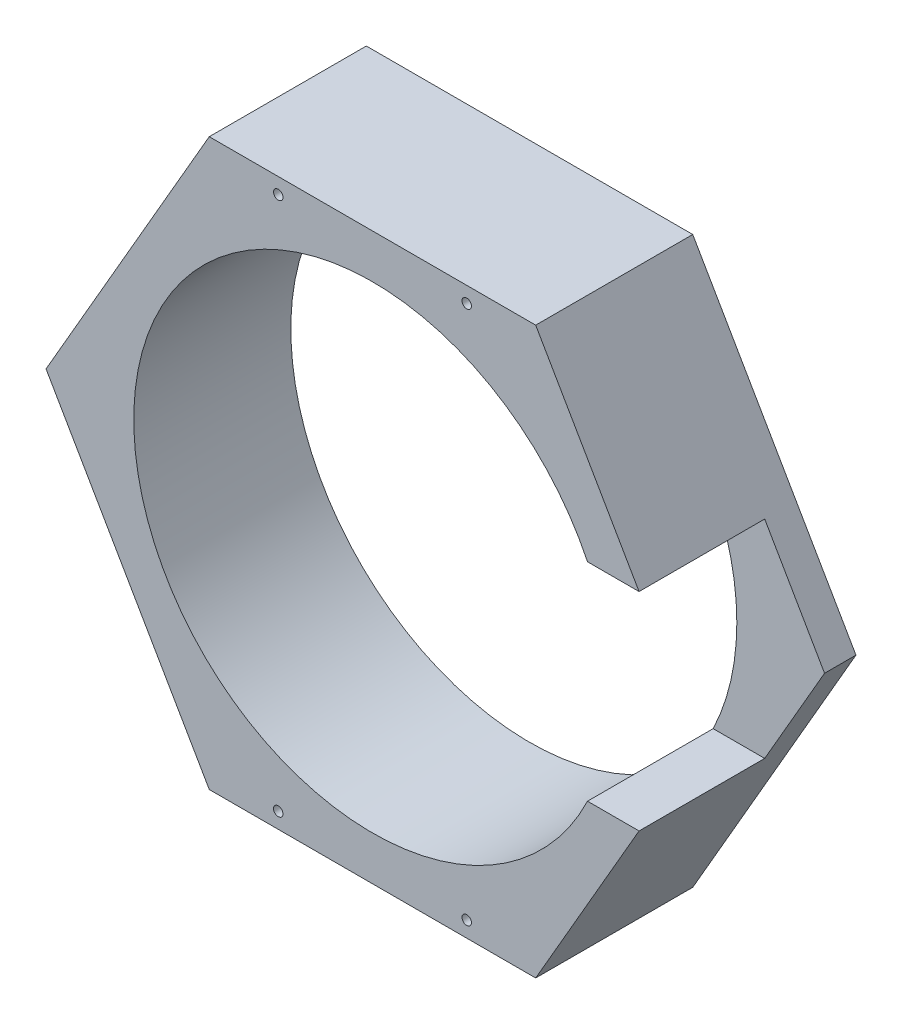
from build123d import *

# Parameters (mm, degrees)
SKETCH1_R           = 76
SKETCH1_R_2         = 1.5
BOSS_EXTRUDE1_DEPTH = 50
CUT_EXTRUDE1_START  = -40
CUT_EXTRUDE1_DEPTH  = 40


with BuildPart() as part:
    # Sketch1 → Boss-Extrude1 (new body)
    with BuildSketch(Plane.XY):
        Polygon((103.923048454, 0), (51.961524227, 90), (-51.961524227, 90), (-103.923048454, 0), (-51.961524227, -90), (51.961524227, -90), align=None)
        Circle(SKETCH1_R, mode=Mode.SUBTRACT)
        with Locations((30, -85)):
            Circle(SKETCH1_R_2, mode=Mode.SUBTRACT)
        with Locations((-30, -85)):
            Circle(SKETCH1_R_2, mode=Mode.SUBTRACT)
        with Locations((30, 85)):
            Circle(SKETCH1_R_2, mode=Mode.SUBTRACT)
        with Locations((-30, 85)):
            Circle(SKETCH1_R_2, mode=Mode.SUBTRACT)
    extrude(amount=BOSS_EXTRUDE1_DEPTH)

    # Sketch4 → Cut-Extrude1 (cut)
    with BuildSketch(Plane.XY.offset(50).offset(CUT_EXTRUDE1_START)):
        with BuildLine():
            ThreePointArc((68.461668107, 33), (74.091452868, 16.925029156), (76, 0))
            Line((76, 0), (103.923048454, 0))
            Line((103.923048454, 0), (84.870489571, 33))
            Line((84.870489571, 33), (68.461668107, 33))
        make_face()
        with BuildLine():
            Line((103.923048454, 0), (76, 0))
            ThreePointArc((76, 0), (74.091452868, -16.925029156), (68.461668107, -33))
            Line((68.461668107, -33), (84.870489571, -33))
            Line((84.870489571, -33), (103.923048454, 0))
        make_face()
    extrude(amount=CUT_EXTRUDE1_DEPTH, mode=Mode.SUBTRACT)


solid = part.part
